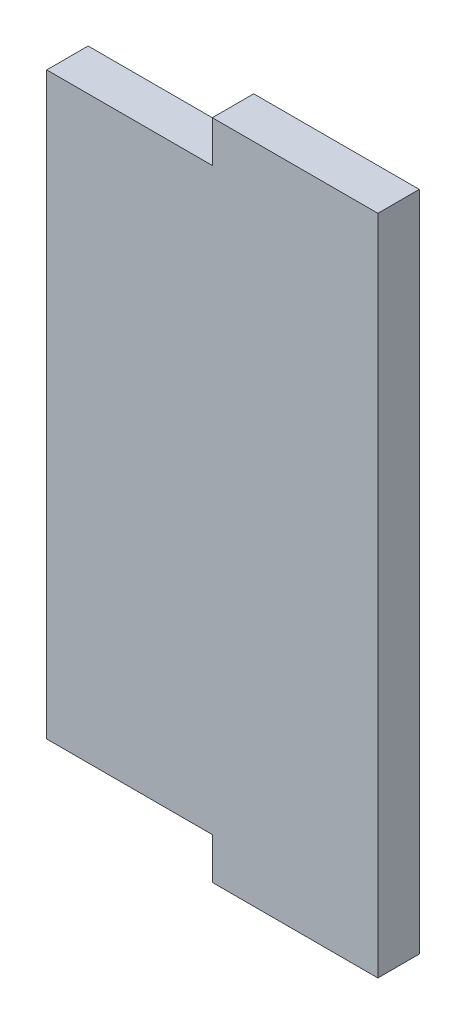
from build123d import *

# Parameters (mm, degrees)
BOSS_EXTRUDE1_DEPTH = 3.175


with BuildPart() as part:
    # Sketch1 → Boss-Extrude1 (new body)
    with BuildSketch(Plane.XY):
        Polygon((98.425, 0), (85.725, 0), (85.725, -3.175), (73.025, -3.175), (73.025, -47.625), (85.725, -47.625), (85.725, -50.8), (98.425, -50.8), align=None)
    extrude(amount=BOSS_EXTRUDE1_DEPTH)


solid = part.part
